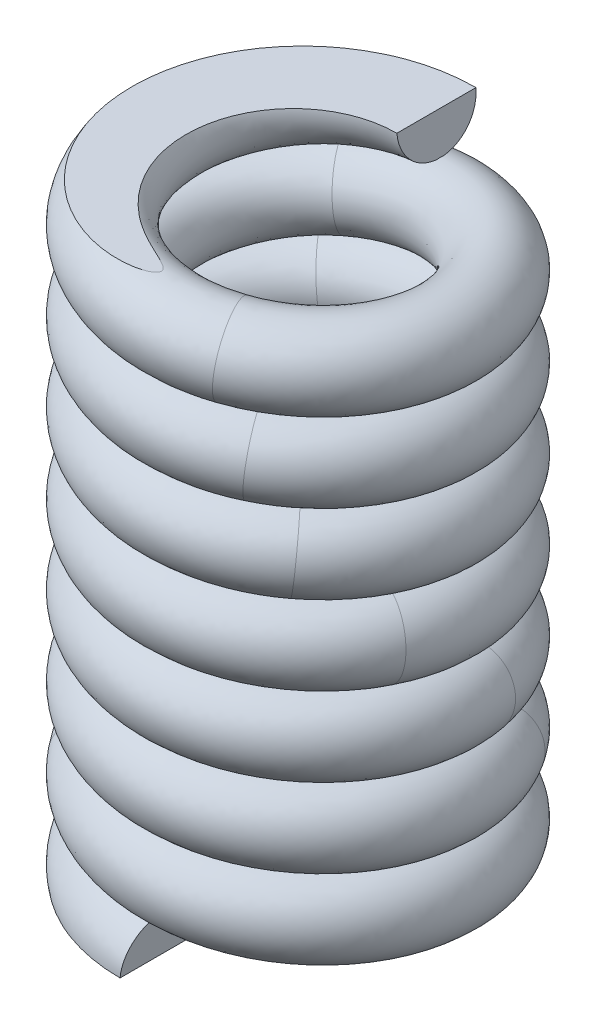
from build123d import *

# Parameters (mm, degrees)
S_P_R1_PITCH          = 2
S_P_R1_HEIGHT         = 15
S_P_R1_RADIUS         = 3.5
S_P_R1_PROFILE_R      = 1
IZIM10_R              = 5
KES_EKSTR_ZYON1_DEPTH = 10
IZIM11_R              = 5
KES_EKSTR_ZYON2_DEPTH = 10


with BuildPart() as part:
    # Süpür1: sweep along a helix
    with BuildLine() as s_p_r1_path:
        Helix(S_P_R1_PITCH, S_P_R1_HEIGHT, S_P_R1_RADIUS, center=(0, 0, 0), direction=(0, 1, 0), lefthand=True)
    # Süpür1 profile (on start of the path) → Süpür1 (sweep)
    with BuildSketch(Plane(origin=(0, 0, 3.5), x_dir=(-0.09057188775690109, -0.9958899201960785, 0), z_dir=(-0.9958899201960785, 0.09057188775690109, -9.876142626402533e-14))):
        Circle(S_P_R1_PROFILE_R)
    sweep(path=s_p_r1_path.line, is_frenet=True)

    # Çizim10 → Kes-Ekstrüzyon1 (cut)
    with BuildSketch(Plane(origin=(0, 0, 0), x_dir=(1, 0, 0), z_dir=(0, 1, 0))):
        Circle(IZIM10_R)
    extrude(amount=-KES_EKSTR_ZYON1_DEPTH, mode=Mode.SUBTRACT)

    # Çizim11 → Kes-Ekstrüzyon2 (cut)
    with BuildSketch(Plane(origin=(0, 15, 0), x_dir=(-1, 0, 0), z_dir=(0, -1, 0))):
        Circle(IZIM11_R)
    extrude(amount=-KES_EKSTR_ZYON2_DEPTH, mode=Mode.SUBTRACT)


solid = part.part
